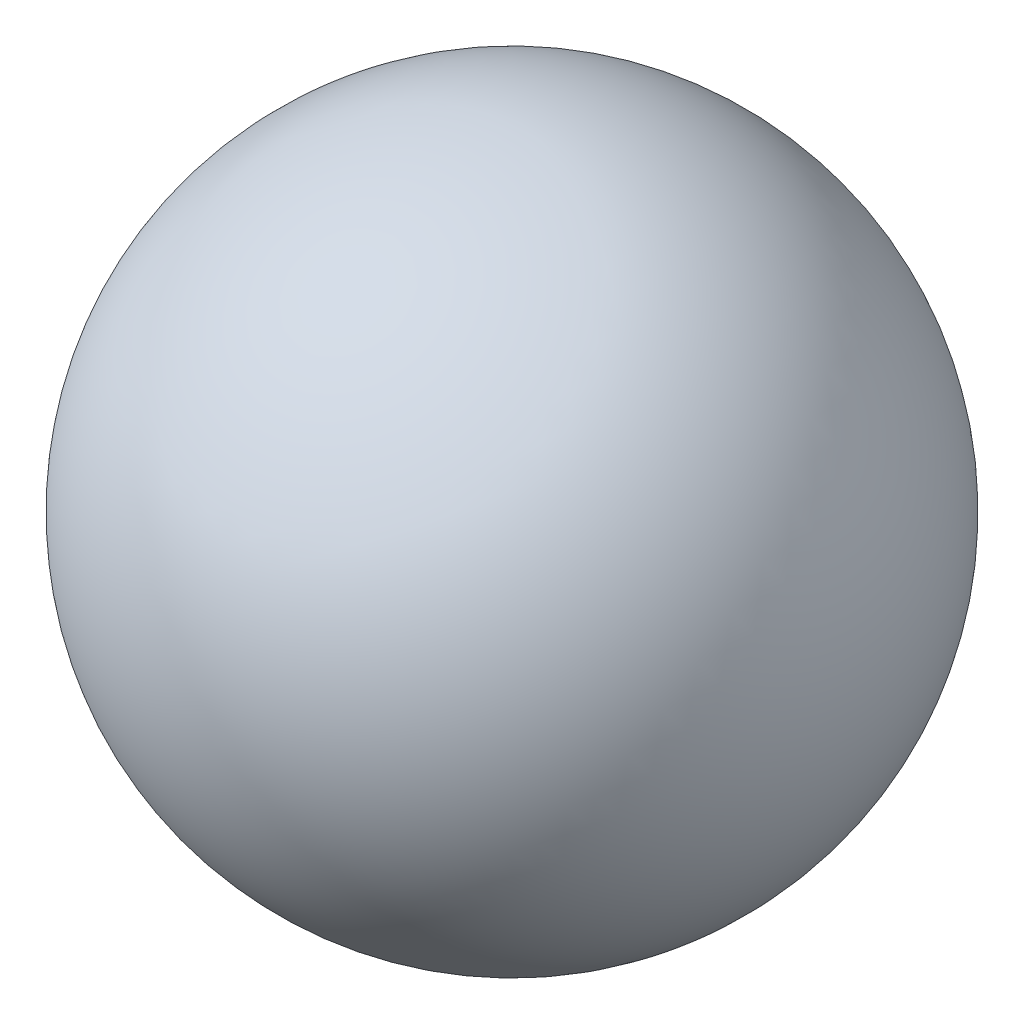
from build123d import *


with BuildPart() as part:
    # Sketch1 → Revolve1 (revolve)
    with BuildSketch(Plane(origin=(0, 0, 0), x_dir=(-1, 0, 0), z_dir=(0, 0, -1))):
        with BuildLine():
            Line((1.604994878, 2.779932675), (2.363755122, 4.094143968))
            ThreePointArc((2.363755122, 4.094143968), (1.327269354, 3.816418443), (1.604994878, 2.779932675))
        make_face()
    revolve(axis=Axis((-1.794684939, 3.108485498, 0), (-0.49999999999998873, 0.8660254037844453, 0)))


solid = part.part
